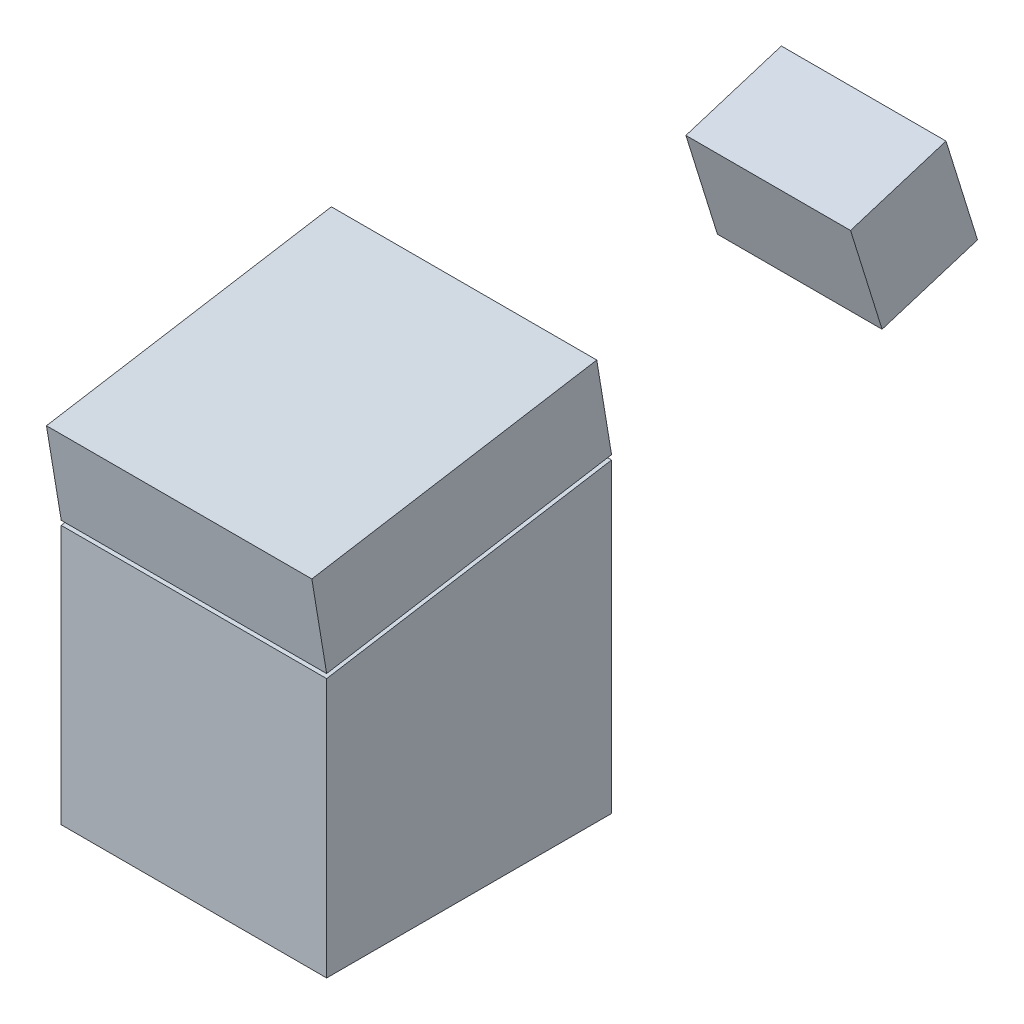
from build123d import *

# Parameters (mm, degrees)
BOSS_EXTRUDE1_START = -160.270086
BOSS_EXTRUDE1_DEPTH = 320.540172
BOSS_EXTRUDE2_START = -160.270086
BOSS_EXTRUDE2_DEPTH = 320.540172
BOSS_EXTRUDE3_START = 99.430357
BOSS_EXTRUDE3_DEPTH = 198.860714


with BuildPart() as part:
    # Sketch2 → Boss-Extrude1 (new body)
    with BuildSketch(Plane(origin=(0, 0, 0), x_dir=(0, 0, -1), z_dir=(1, 0, 0)).offset(BOSS_EXTRUDE1_START)):
        Polygon((-1035.044323606, 461.416773344), (-1379.153061364, 404.802482299), (-1379.153061364, 91.654684957), (-1035.044323606, 91.654684957), align=None)
    extrude(amount=BOSS_EXTRUDE1_DEPTH)


with BuildPart() as body_2:
    # Sketch3 → Boss-Extrude2 (new body)
    with BuildSketch(Plane(origin=(0, 0, 0), x_dir=(0, 0, -1), z_dir=(1, 0, 0)).offset(BOSS_EXTRUDE2_START)):
        Polygon((-1379.153061364, 410.05637394), (-1035.044323606, 466.987725211), (-1052.899911105, 574.91180463), (-1397.008648862, 517.980453359), align=None)
    extrude(amount=BOSS_EXTRUDE2_DEPTH)


with BuildPart() as body_3:
    # Sketch4 → Boss-Extrude3 (new body)
    with BuildSketch(Plane(origin=(0, 0, 0), x_dir=(0, 0, -1), z_dir=(1, 0, 0)).offset(BOSS_EXTRUDE3_START)):
        Polygon((-647.4564319, 373.924864574), (-532.171112015, 409.797007159), (-570.257367388, 532.19800742), (-685.542687273, 496.325864836), align=None)
    extrude(amount=-BOSS_EXTRUDE3_DEPTH)


solid = Compound([part.part, body_2.part, body_3.part])
